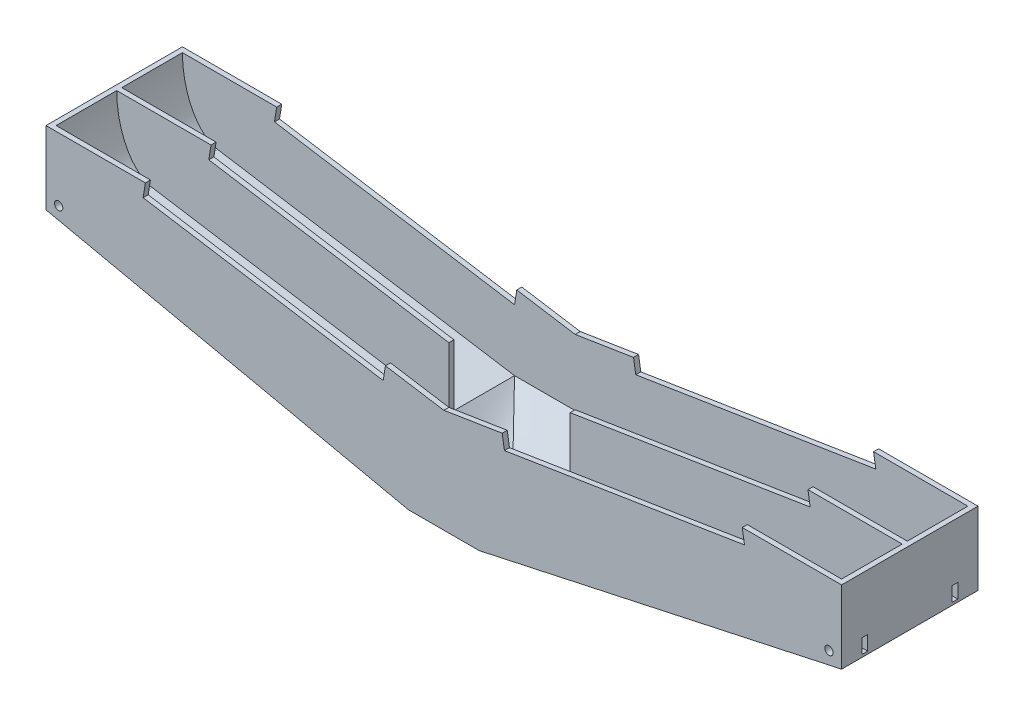
from build123d import *

# Parameters (mm, degrees)
SKETCH1_W               = 315
SKETCH1_H               = 54
BOSS_EXTRUDE2_DEPTH     = 60
CUT_EXTRUDE2_DEPTH      = 25
CUT_EXTRUDE2_DEPTH_BACK = 25
BOSS_EXTRUDE3_DEPTH     = 1
SKETCH9_W               = 48
SKETCH9_H               = 50
CUT_EXTRUDE5_DEPTH      = 167.012800738
SKETCH10_R              = 12
CUT_EXTRUDE6_DEPTH      = 2
SKETCH11_R              = 1.65
CUT_EXTRUDE7_DEPTH      = 177.98093121
CUT_EXTRUDE8_DEPTH      = 2.3
CUT_EXTRUDE9_DEPTH      = 2.3


with BuildPart() as part:
    # Sketch1 → Boss-Extrude2 (new body)
    with BuildSketch(Plane(origin=(0, 0, 0), x_dir=(1, 0, 0), z_dir=(0, 1, 0))):
        Rectangle(SKETCH1_W, SKETCH1_H)
    extrude(amount=BOSS_EXTRUDE2_DEPTH)

    # Sketch7 → Cut-Extrude2 (cut, two sides: drawn at the far end of the back side and taken through both)
    with BuildSketch(Plane.XY.offset(-CUT_EXTRUDE2_DEPTH_BACK)):
        with BuildLine():
            Line((-141.5, 33.764258555), (-24, 15))
            Line((-24, 15), (24, 15))
            Line((24, 15), (141.5, 33.764258555))
            add(Edge.make_bspline(
                [(141.5, 33.764258555), (155.5, 36), (155.5, 60)],
                knots=[3.234883811, 3.234883811, 3.234883811, 4.71238898, 4.71238898, 4.71238898], degree=2, weights=[1, 0.739309101, 1]))
            Line((155.5, 60), (-155.5, 60))
            add(Edge.make_bspline(
                [(-155.5, 60), (-155.5, 36), (-141.5, 33.764258555)],
                knots=[4.71238898, 4.71238898, 4.71238898, 6.18989415, 6.18989415, 6.18989415], degree=2, weights=[1, 0.739309101, 1]))
        make_face()
    extrude(amount=CUT_EXTRUDE2_DEPTH + CUT_EXTRUDE2_DEPTH_BACK, mode=Mode.SUBTRACT)

    # Sketch7<2> → Boss-Extrude3 (add, symmetric)
    with BuildSketch(Plane.XY):
        with BuildLine():
            Line((-141.5, 33.764258555), (-24, 15))
            Line((-24, 15), (24, 15))
            Line((24, 15), (141.5, 33.764258555))
            add(Edge.make_bspline(
                [(141.5, 33.764258555), (155.5, 36), (155.5, 60)],
                knots=[3.234883811, 3.234883811, 3.234883811, 4.71238898, 4.71238898, 4.71238898], degree=2, weights=[1, 0.739309101, 1]))
            Line((155.5, 60), (-155.5, 60))
            add(Edge.make_bspline(
                [(-155.5, 60), (-155.5, 36), (-141.5, 33.764258555)],
                knots=[4.71238898, 4.71238898, 4.71238898, 6.18989415, 6.18989415, 6.18989415], degree=2, weights=[1, 0.739309101, 1]))
        make_face()
    extrude(amount=BOSS_EXTRUDE3_DEPTH, both=True)

    # Sketch9 → Cut-Extrude5 (cut, through all)
    with BuildSketch(Plane(origin=(0, 15, 0), x_dir=(1, 0, 0), z_dir=(0, 1, 0))):
        Rectangle(SKETCH9_W, SKETCH9_H)
    extrude(amount=CUT_EXTRUDE5_DEPTH, mode=Mode.SUBTRACT)

    # Sketch10 → Cut-Extrude6 (cut)
    with BuildSketch(Plane.XZ):
        with Locations(Location((0, 0, 0), (0, 0, 270))):
            Circle(SKETCH10_R)
    extrude(amount=-CUT_EXTRUDE6_DEPTH, mode=Mode.SUBTRACT)

    # Sketch4 for Cut-Loft3 → Cut-Loft3 section 0
    with BuildSketch(Plane.XZ.offset(-2)):
        with BuildLine():
            # circular arc as an exact rational Bezier (weights 1, cos(half-angle), 1)
            Bezier((-8.310381938, 8.656647852), (0, 16.634614514), (8.310381938, 8.656647852), weights=[1, 0.721387321, 1])
            Bezier((8.310381938, 8.656647852), (17.327723452, 0), (8.310381938, -8.656647852), weights=[1, 0.692531828, 1])
            Bezier((8.310381938, -8.656647852), (0, -16.634614514), (-8.310381938, -8.656647852), weights=[1, 0.721387321, 1])
            Bezier((-8.310381938, -8.656647852), (-17.327723452, 0), (-8.310381938, 8.656647852), weights=[1, 0.692531828, 1])
        make_face()
    # Sketch9<2> → Cut-Loft3 section 1
    with BuildSketch(Plane(origin=(0, 15, 0), x_dir=(1, 0, 0), z_dir=(0, 1, 0))):
        with BuildLine():
            Line((-24, -25), (24, -25))
            Line((24, -25), (24, 25))
            Line((24, 25), (-24, 25))
            Line((-24, 25), (-24, -25))
        make_face()
    loft(mode=Mode.SUBTRACT)

    # Sketch11 → Cut-Extrude7 (cut, through all)
    with BuildSketch(Plane.XY.offset(27)):
        with Locations((-152.5, 35)):
            Circle(SKETCH11_R)
        with Locations((152.5, 35)):
            Circle(SKETCH11_R)
        Polygon((-157.5, 31.091711648), (-14, 0), (-157.5, 0), align=None)
        Polygon((157.5, 31.091711648), (157.5, 0), (14, 0), align=None)
        Polygon((-118.160810021, 60), (-119.042024296, 54.481920135), (-24, 39.304106369), (-23.118785725, 44.822186234), (0, 41.130212848), (23.118785725, 44.822186234), (24, 39.304106369), (119.042024296, 54.481920135), (118.160810021, 60), align=None)
    extrude(amount=-CUT_EXTRUDE7_DEPTH, mode=Mode.SUBTRACT)

    # Sketch12 → Cut-Extrude8 (cut)
    with BuildSketch(Plane.XY.offset(19)):
        Polygon((-150.854551733, 37.85), (-157.5, 37.85), (-157.5, 32.15), (-150.854551733, 32.15), (-149.209103466, 35), align=None)
        Polygon((157.5, 37.85), (157.5, 32.15), (150.854551733, 32.15), (149.209103466, 35), (150.854551733, 37.85), align=None)
    extrude(amount=-CUT_EXTRUDE8_DEPTH, mode=Mode.SUBTRACT)

    # Sketch13 → Cut-Extrude9 (cut)
    with BuildSketch(Plane(origin=(0, 0, -19), x_dir=(-1, 0, 0), z_dir=(0, 0, -1))):
        Polygon((-150.854551733, 37.85), (-157.5, 37.85), (-157.5, 32.15), (-150.854551733, 32.15), (-149.209103466, 35), align=None)
        Polygon((157.5, 37.85), (157.5, 32.15), (150.854551733, 32.15), (149.209103466, 35), (150.854551733, 37.85), align=None)
    extrude(amount=-CUT_EXTRUDE9_DEPTH, mode=Mode.SUBTRACT)


solid = part.part
